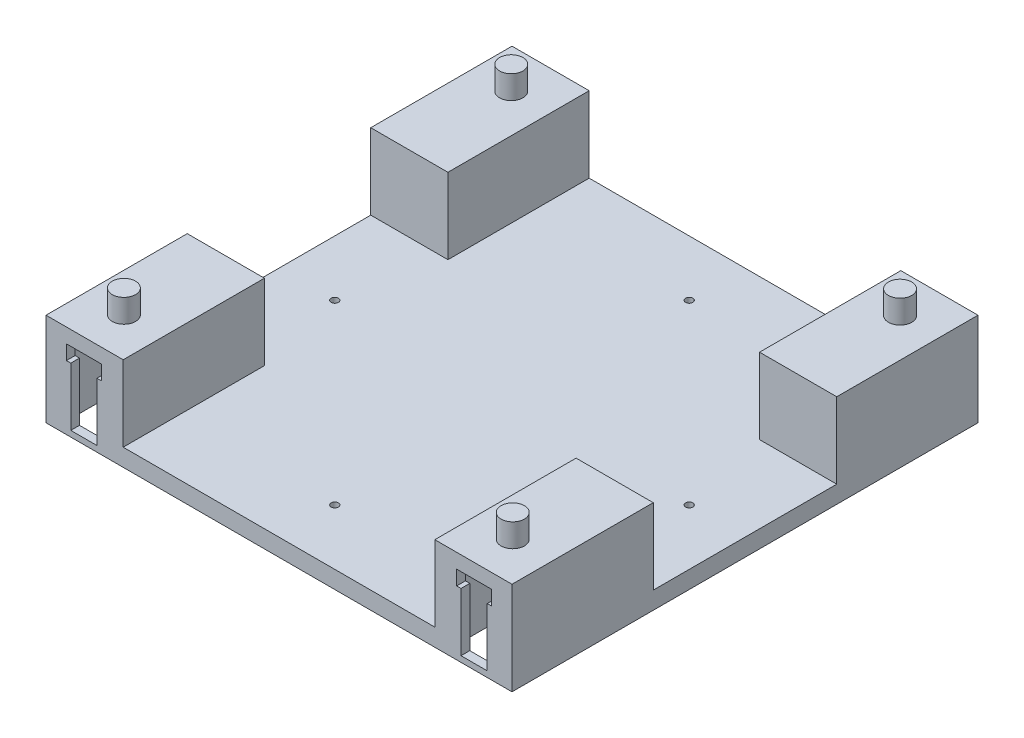
from build123d import *

# Parameters (mm, degrees)
SKETCH2_W           = 160
SKETCH2_H           = 160
BOSS_EXTRUDE2_DEPTH = 6
SKETCH3_W           = 26.5
SKETCH3_H           = 48.5
BOSS_EXTRUDE3_DEPTH = 32
SKETCH4_W           = 20.5
SKETCH4_H           = 42.5
CUT_EXTRUDE2_DEPTH  = 29
SKETCH5_R           = 4
BOSS_EXTRUDE4_DEPTH = 8
CUT_EXTRUDE3_DEPTH  = 8
SKETCH7_R           = 1.25
CUT_EXTRUDE4_DEPTH  = 10


with BuildPart() as part:
    # Sketch2 → Boss-Extrude2 (new body)
    with BuildSketch(Plane(origin=(0, 0, 0), x_dir=(1, 0, 0), z_dir=(0, 1, 0))):
        Rectangle(SKETCH2_W, SKETCH2_H)
    extrude(amount=BOSS_EXTRUDE2_DEPTH)

    # Sketch3 → Boss-Extrude3 (add)
    with BuildSketch(Plane(origin=(0, 0, 0), x_dir=(1, 0, 0), z_dir=(0, 1, 0))):
        with Locations((-66.75, 55.75)):
            Rectangle(SKETCH3_W, SKETCH3_H)
        with Locations((66.75, 55.75)):
            Rectangle(SKETCH3_W, SKETCH3_H)
        with Locations((66.75, -55.75)):
            Rectangle(SKETCH3_W, SKETCH3_H)
        with Locations((-66.75, -55.75)):
            Rectangle(SKETCH3_W, SKETCH3_H)
    extrude(amount=BOSS_EXTRUDE3_DEPTH)

    # Sketch4 → Cut-Extrude2 (cut)
    with BuildSketch(Plane(origin=(0, 0, 0), x_dir=(1, 0, 0), z_dir=(0, 1, 0))):
        with Locations((-66.75, 55.75)):
            Rectangle(SKETCH4_W, SKETCH4_H)
        with Locations((66.75, 55.75)):
            Rectangle(SKETCH4_W, SKETCH4_H)
        with Locations((66.75, -55.75)):
            Rectangle(SKETCH4_W, SKETCH4_H)
        with Locations((-66.75, -55.75)):
            Rectangle(SKETCH4_W, SKETCH4_H)
    extrude(amount=CUT_EXTRUDE2_DEPTH, mode=Mode.SUBTRACT)

    # Sketch5 → Boss-Extrude4 (add)
    with BuildSketch(Plane(origin=(0, 32, 0), x_dir=(1, 0, 0), z_dir=(0, 1, 0))):
        with Locations(Location((-66.75, 66.5, 0), (0, 0, 270))):
            Circle(SKETCH5_R)
        with Locations(Location((66.75, 66.5, 0), (0, 0, 90))):
            Circle(SKETCH5_R)
        with Locations(Location((66.75, -66.5, 0), (0, 0, 270))):
            Circle(SKETCH5_R)
        with Locations(Location((-66.75, -66.5, 0), (0, 0, 90))):
            Circle(SKETCH5_R)
    extrude(amount=BOSS_EXTRUDE4_DEPTH)

    # Sketch6 → Cut-Extrude3 (cut)
    with BuildSketch(Plane.XY.offset(80)):
        Polygon((-73, 27), (-61, 27), (-61, 22), (-62.5, 22), (-62.5, 2), (-71.5, 2), (-71.5, 22), (-73, 22), align=None)
        Polygon((73, 22), (73, 27), (61, 27), (61, 22), (62.5, 22), (62.5, 2), (71.5, 2), (71.5, 22), align=None)
    cut_extrude3 = extrude(amount=-CUT_EXTRUDE3_DEPTH, mode=Mode.SUBTRACT)

    # Mirror1: Cut-Extrude3 across plane
    add(cut_extrude3.mirror(Plane.XY), mode=Mode.SUBTRACT)

    # Sketch7 → Cut-Extrude4 (cut)
    with BuildSketch(Plane(origin=(0, 6, 0), x_dir=(1, 0, 0), z_dir=(0, 1, 0))):
        with Locations(Location((-60.85, 0, 0), (0, 0, 270))):
            Circle(SKETCH7_R)
        with Locations(Location((0, 60.85, 0), (0, 0, 270))):
            Circle(SKETCH7_R)
        with Locations(Location((60.85, 0, 0), (0, 0, 270))):
            Circle(SKETCH7_R)
        with Locations(Location((0, -60.85, 0), (0, 0, 270))):
            Circle(SKETCH7_R)
    extrude(amount=-CUT_EXTRUDE4_DEPTH, mode=Mode.SUBTRACT)


solid = part.part
